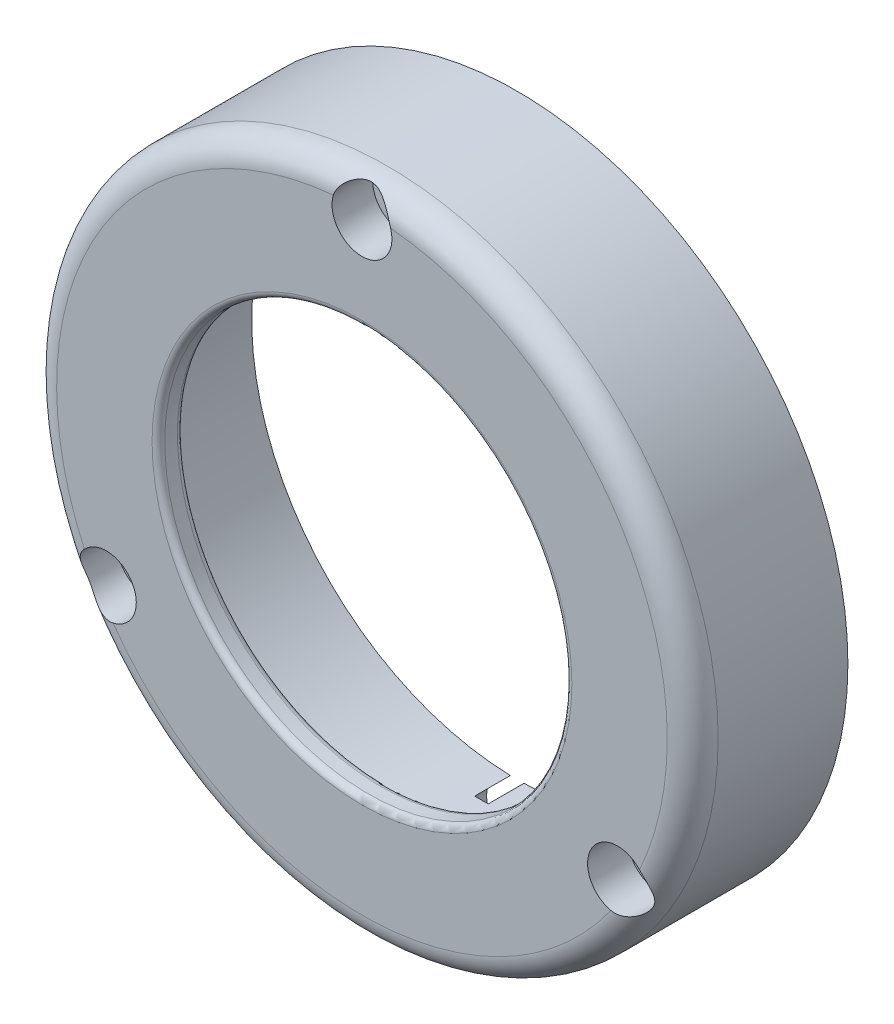
from build123d import *

# Parameters (mm, degrees)
SKETCH1_R            = 41.275
SKETCH1_R_2          = 33.126045
BOSS_EXTRUDE1_DEPTH  = 16.1925
SKETCH2_R            = 41.275
SKETCH2_R_2          = 25.4
BOSS_EXTRUDE2_DEPTH  = 3.175
FILLET1_R            = 1.5875
FILLET2_R            = 3.175
M4_CLEARANCE_HOLE1_D = 4.3
CUT_EXTRUDE1_DEPTH   = 5.08
CIRPATTERN1_COUNT    = 3
FILLET3_R            = 0.79375
SKETCH8_R            = 3.81
CUT_EXTRUDE2_DEPTH   = 4.445
CIRPATTERN2_COUNT    = 3


with BuildPart() as part:
    # Sketch1 → Boss-Extrude1 (new body)
    with BuildSketch(Plane.XY):
        Circle(SKETCH1_R)
        Circle(SKETCH1_R_2, mode=Mode.SUBTRACT)
    extrude(amount=BOSS_EXTRUDE1_DEPTH)

    # Sketch2 → Boss-Extrude2 (add)
    with BuildSketch(Plane.XY.offset(16.1925)):
        Circle(SKETCH2_R)
        Circle(SKETCH2_R_2, mode=Mode.SUBTRACT)
    extrude(amount=BOSS_EXTRUDE2_DEPTH)

    # Fillet1
    fillet1_edges = [part.edges().sort_by_distance(p)[0] for p in [
        (-33.126045, 0, 16.1925),
    ]]
    fillet(fillet1_edges, radius=FILLET1_R)

    # Fillet2
    fillet2_edges = [part.edges().sort_by_distance(p)[0] for p in [
        (-41.275, 0, 19.3675),
    ]]
    fillet(fillet2_edges, radius=FILLET2_R)

    # M4 Clearance Hole1 (through all)
    with Locations(Plane.XY.offset(19.3675)):
        with Locations((0, 36.83)):
            m4_clearance_hole1 = Hole(M4_CLEARANCE_HOLE1_D / 2)

    # Sketch7 → Cut-Extrude1 (cut)
    with BuildSketch(Plane.XY.offset(19.3675)):
        with BuildLine():
            ThreePointArc((3.066495238, 38.966706158), (0, 40.5675), (-3.066495238, 38.966706158))
            ThreePointArc((-3.066495238, 38.966706158), (0, 33.0925), (3.066495238, 38.966706158))
        make_face()
    cut_extrude1 = extrude(amount=-CUT_EXTRUDE1_DEPTH, mode=Mode.SUBTRACT)

    # CirPattern1: M4 Clearance Hole1, Cut-Extrude1 ×3 about axis
    cirpattern1_axis = Axis((0, 0, 0), (0, 0, 1))
    add([m4_clearance_hole1.rotate(cirpattern1_axis, i * 360 / CIRPATTERN1_COUNT) for i in range(1, CIRPATTERN1_COUNT)], mode=Mode.SUBTRACT)
    add([cut_extrude1.rotate(cirpattern1_axis, i * 360 / CIRPATTERN1_COUNT) for i in range(1, CIRPATTERN1_COUNT)], mode=Mode.SUBTRACT)

    # Fillet3
    fillet3_edges = [part.edges().sort_by_distance(p)[0] for p in [
        (-25.4, 0, 19.3675),
        (-25.4, 0, 16.1925),
    ]]
    fillet(fillet3_edges, radius=FILLET3_R)

    # Sketch8 → Cut-Extrude2 (cut)
    with BuildSketch(Plane(origin=(0, 0, 0), x_dir=(-1, 0, 0), z_dir=(0, 0, -1))):
        with Locations((31.895715621, 18.415)):
            Circle(SKETCH8_R)
    cut_extrude2 = extrude(amount=-CUT_EXTRUDE2_DEPTH, mode=Mode.SUBTRACT)

    # CirPattern2: Cut-Extrude2 ×3 about axis
    cirpattern2_axis = Axis((0, 0, 0), (0, 0, 1))
    for i in range(1, CIRPATTERN2_COUNT):
        add(cut_extrude2.rotate(cirpattern2_axis, i * 360 / CIRPATTERN2_COUNT), mode=Mode.SUBTRACT)


solid = part.part
